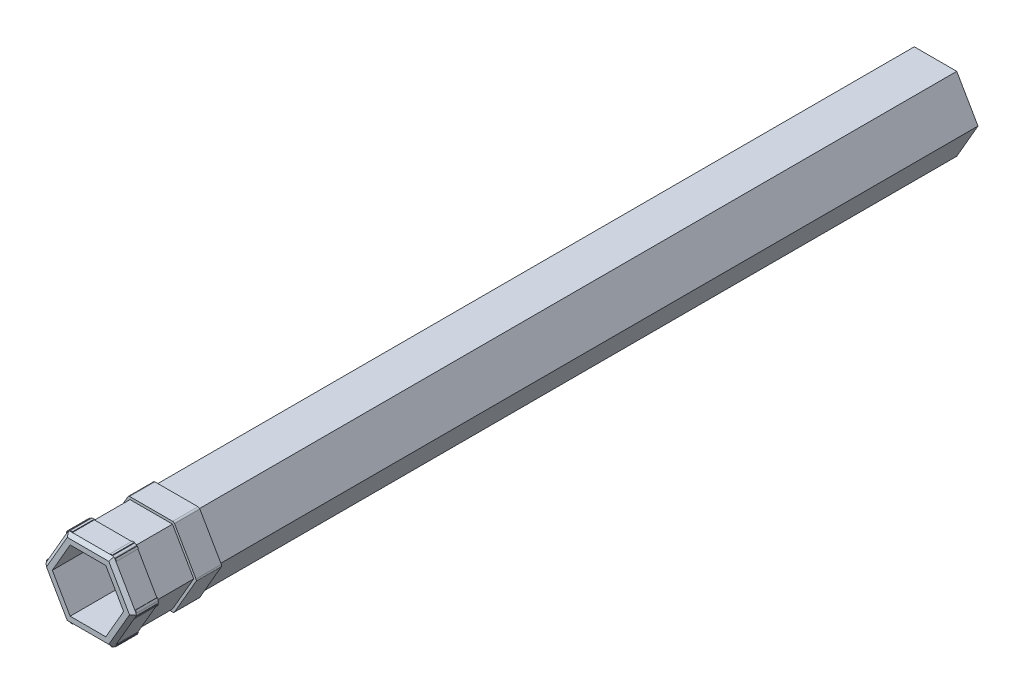
from build123d import *

# Parameters (mm, degrees)
TUBE_FULL_AF_EXTRUSION_DEPTH    = 201
TUBE_BORE_CUT_DEPTH             = 202.504085463
TUBE_BORE_CUT_DEPTH_BACK        = 202.504085463
T4_LOWER_BODY_RELIEF_START      = -6
T4_LOWER_BODY_RELIEF_DEPTH      = 9
T4_UPPER_BODY_RELIEF_START      = 6
T4_UPPER_BODY_RELIEF_DEPTH      = 180
T4_BOTTOM_END_CHAMFER_SIZE      = 0.8
T4_TUBE_MOUTH_CHAMFER_SIZE      = 0.8
T4_GUIDE_BAND_CORNER_FILLETS_R  = 0.5
T4_STOP_BAND_CORNER_FILLETS_R   = 0.5
T4_GUIDE_BAND_RIB_PROFILE_W     = 0.5
T4_GUIDE_BAND_RIB_PROFILE_H     = 5.2
T4_GUIDE_BAND_RIBS_MASTER_DEPTH = 0.15
T4_GUIDE_BAND_RIB_PATTERN_COUNT = 6


with BuildPart() as part:
    # Tube_Full_AF_Profile → Tube_Full_AF_Extrusion (new body)
    with BuildSketch(Plane.XY):
        Polygon((5.38379126, 9.325), (-5.38379126, 9.325), (-10.76758252, 0), (-5.38379126, -9.325), (5.38379126, -9.325), (10.76758252, 0), align=None)
    extrude(amount=TUBE_FULL_AF_EXTRUSION_DEPTH)

    # Tube_Bore_Profile → Tube_Bore_Cut (cut, two sides: drawn at the far end of the back side and taken through both)
    with BuildSketch(Plane.XY.offset(201).offset(-TUBE_BORE_CUT_DEPTH_BACK)):
        Polygon((8.458181444, 0), (4.229090722, 7.325), (-4.229090722, 7.325), (-8.458181444, 0), (-4.229090722, -7.325), (4.229090722, -7.325), align=None)
    extrude(amount=TUBE_BORE_CUT_DEPTH + TUBE_BORE_CUT_DEPTH_BACK, mode=Mode.SUBTRACT)

    # T4_Lower_Relief_Profile → T4_Lower_Body_Relief (cut)
    with BuildSketch(Plane.XY.offset(201).offset(T4_LOWER_BODY_RELIEF_START)):
        Polygon((10.76758252, 0), (5.38379126, 9.325), (-5.38379126, 9.325), (-10.76758252, 0), (-5.38379126, -9.325), (5.38379126, -9.325), align=None)
        Polygon((10.074762197, 0), (5.037381099, 8.725), (-5.037381099, 8.725), (-10.074762197, 0), (-5.037381099, -8.725), (5.037381099, -8.725), align=None, mode=Mode.SUBTRACT)
    extrude(amount=-T4_LOWER_BODY_RELIEF_DEPTH, mode=Mode.SUBTRACT)

    # T4_Upper_Relief_Profile → T4_Upper_Body_Relief (cut)
    with BuildSketch(Plane.XY.offset(174).offset(T4_UPPER_BODY_RELIEF_START)):
        Polygon((5.38379126, -9.325), (10.76758252, 0), (5.38379126, 9.325), (-5.38379126, 9.325), (-10.76758252, 0), (-5.38379126, -9.325), align=None)
        Polygon((5.037381099, 8.725), (10.074762197, 0), (5.037381099, -8.725), (-5.037381099, -8.725), (-10.074762197, 0), (-5.037381099, 8.725), align=None, mode=Mode.SUBTRACT)
    extrude(amount=-T4_UPPER_BODY_RELIEF_DEPTH, mode=Mode.SUBTRACT)

    # T4_Bottom_End_Chamfer
    t4_bottom_end_chamfer_edges = [part.edges().sort_by_distance(p)[0] for p in [
        (0, 9.325, 201),
        (-8.07568689, 4.6625, 201),
        (-8.07568689, -4.6625, 201),
        (0, -9.325, 201),
        (8.07568689, -4.6625, 201),
        (8.07568689, 4.6625, 201),
    ]]
    chamfer(t4_bottom_end_chamfer_edges, length=T4_BOTTOM_END_CHAMFER_SIZE)

    # T4_Tube_Mouth_Chamfer
    t4_tube_mouth_chamfer_edges = [part.edges().sort_by_distance(p)[0] for p in [
        (6.343636083, 3.6625, 0),
        (6.343636083, -3.6625, 0),
        (0, -7.325, 0),
        (-6.343636083, -3.6625, 0),
        (-6.343636083, 3.6625, 0),
        (0, 7.325, 0),
    ]]
    chamfer(t4_tube_mouth_chamfer_edges, length=T4_TUBE_MOUTH_CHAMFER_SIZE)

    # T4_Guide_Band_Corner_Fillets
    t4_guide_band_corner_fillets_edges = [part.edges().sort_by_distance(p)[0] for p in [
        (10.76758252, 0, 197.6),
        (5.38379126, -9.325, 197.6),
        (-5.38379126, -9.325, 197.6),
        (-10.76758252, 0, 197.6),
        (-5.38379126, 9.325, 197.6),
        (5.38379126, 9.325, 197.6),
    ]]
    fillet(t4_guide_band_corner_fillets_edges, radius=T4_GUIDE_BAND_CORNER_FILLETS_R)

    # T4_Stop_Band_Corner_Fillets
    t4_stop_band_corner_fillets_edges = [part.edges().sort_by_distance(p)[0] for p in [
        (-5.38379126, 9.325, 183),
        (-10.76758252, 0, 183),
        (-5.38379126, -9.325, 183),
        (5.38379126, -9.325, 183),
        (10.76758252, 0, 183),
        (5.38379126, 9.325, 183),
    ]]
    fillet(t4_stop_band_corner_fillets_edges, radius=T4_STOP_BAND_CORNER_FILLETS_R)

    # T4_Guide_Band_Rib_Profile → T4_Guide_Band_Ribs_Master (add)
    with BuildSketch(Plane(origin=(0, 9.325, 0), x_dir=(1, 0, 0), z_dir=(0, 1, 0))):
        with Locations((-4.75, -197.6)):
            Rectangle(T4_GUIDE_BAND_RIB_PROFILE_W, T4_GUIDE_BAND_RIB_PROFILE_H)
        with Locations((4.75, -197.6)):
            Rectangle(T4_GUIDE_BAND_RIB_PROFILE_W, T4_GUIDE_BAND_RIB_PROFILE_H)
    t4_guide_band_ribs_master = extrude(amount=T4_GUIDE_BAND_RIBS_MASTER_DEPTH)

    # T4_Guide_Band_Rib_Pattern: T4_Guide_Band_Ribs_Master ×6 about axis
    t4_guide_band_rib_pattern_axis = Axis((0, 0, -78.876304343), (0, 0, 1))
    for i in range(1, T4_GUIDE_BAND_RIB_PATTERN_COUNT):
        add(t4_guide_band_ribs_master.rotate(t4_guide_band_rib_pattern_axis, i * 360 / T4_GUIDE_BAND_RIB_PATTERN_COUNT))


solid = part.part
